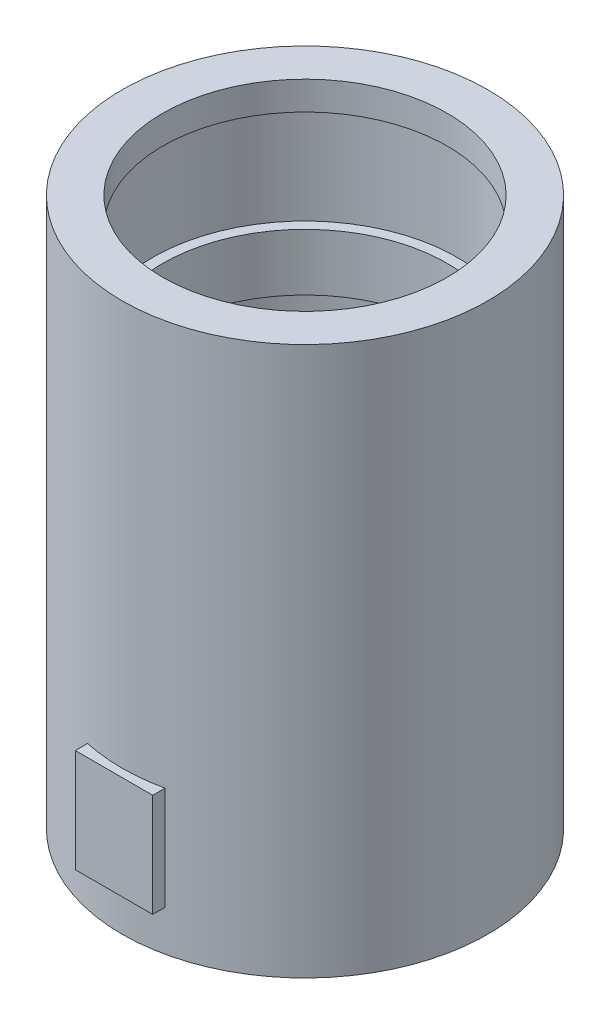
from build123d import *

# Parameters (mm, degrees)
SKETCH1_R                = 45
BOSS_EXTRUDE1_DEPTH      = 135
SKETCH2_R                = 35
CUT_EXTRUDE1_DEPTH       = 90
SKETCH3_R                = 37.5
SKETCH3_R_2              = 35
CUT_EXTRUDE2_DEPTH       = 25
SKETCH4_R                = 37.5
SKETCH4_R_2              = 35
CUT_EXTRUDE3_DEPTH       = 25
SKETCH5_R                = 7.5
CUT_EXTRUDE4_DEPTH       = 5
BOSS_EXTRUDE2_DEPTH      = 2
BOSS_EXTRUDE2_DEPTH_BACK = 4
SKETCH6_W                = 19.05
SKETCH6_H                = 25.4


with BuildPart() as part:
    # Sketch1 → Boss-Extrude1 (new body)
    with BuildSketch(Plane(origin=(0, 0, 0), x_dir=(1, 0, 0), z_dir=(0, 1, 0))):
        with Locations(Location((0, 0, 0), (0, 0, 270))):
            Circle(SKETCH1_R)
    extrude(amount=BOSS_EXTRUDE1_DEPTH)

    # Sketch2 → Cut-Extrude1 (cut)
    with BuildSketch(Plane(origin=(0, 135, 0), x_dir=(1, 0, 0), z_dir=(0, 1, 0))):
        with Locations(Location((0, 0, 0), (0, 0, 270))):
            Circle(SKETCH2_R)
    extrude(amount=-CUT_EXTRUDE1_DEPTH, mode=Mode.SUBTRACT)

    # Sketch3 → Cut-Extrude2 (cut)
    with BuildSketch(Plane(origin=(0, 128, 0), x_dir=(1, 0, 0), z_dir=(0, 1, 0))):
        with Locations(Location((0, 0, 0), (0, 0, 270))):
            Circle(SKETCH3_R)
        with Locations(Location((0, 0, 0), (0, 0, 270))):
            Circle(SKETCH3_R_2, mode=Mode.SUBTRACT)
    extrude(amount=-CUT_EXTRUDE2_DEPTH, mode=Mode.SUBTRACT)

    # Sketch4 → Cut-Extrude3 (cut)
    with BuildSketch(Plane(origin=(0, 89, 0), x_dir=(1, 0, 0), z_dir=(0, 1, 0))):
        with Locations(Location((0, 0, 0), (0, 0, 270))):
            Circle(SKETCH4_R)
        with Locations(Location((0, 0, 0), (0, 0, 270))):
            Circle(SKETCH4_R_2, mode=Mode.SUBTRACT)
    extrude(amount=-CUT_EXTRUDE3_DEPTH, mode=Mode.SUBTRACT)

    # Sketch5 → Cut-Extrude4 (cut)
    with BuildSketch(Plane(origin=(0, 45, 0), x_dir=(1, 0, 0), z_dir=(0, 1, 0))):
        with Locations(Location((0, 0, 0), (0, 0, 270))):
            Circle(SKETCH5_R)
    extrude(amount=-CUT_EXTRUDE4_DEPTH, mode=Mode.SUBTRACT)

    # Sketch6 → Boss-Extrude2 (add, two sides: drawn at the far end of the back side and taken through both)
    with BuildSketch(Plane.XY.offset(45).offset(-BOSS_EXTRUDE2_DEPTH_BACK)):
        with Locations((0, 22.7)):
            Rectangle(SKETCH6_W, SKETCH6_H)
    extrude(amount=BOSS_EXTRUDE2_DEPTH + BOSS_EXTRUDE2_DEPTH_BACK)


solid = part.part
